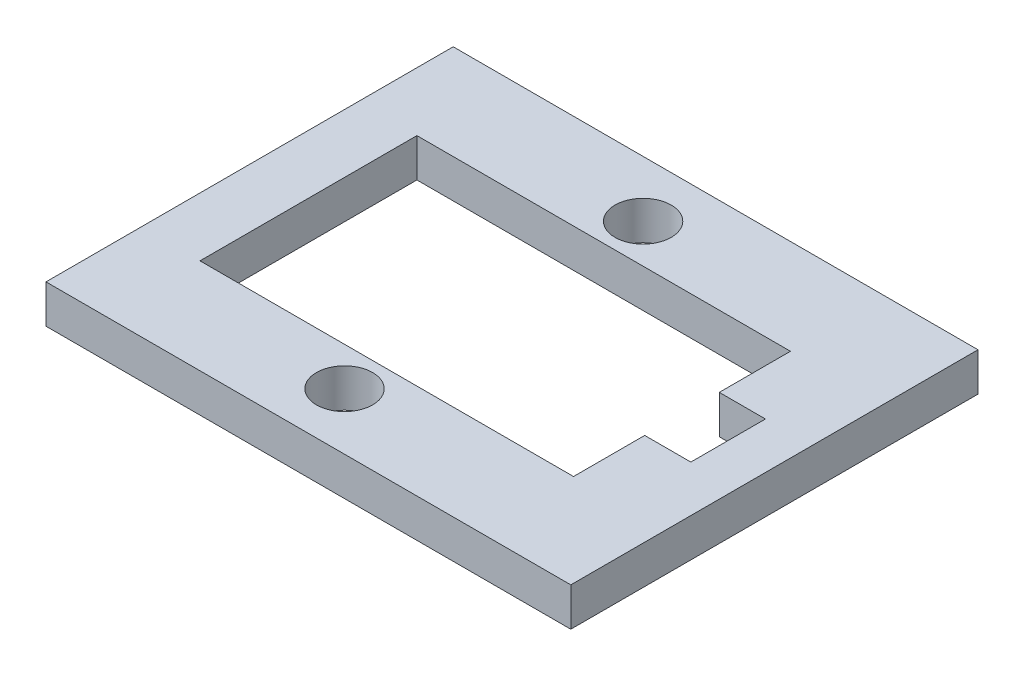
from build123d import *

# Parameters (mm, degrees)
SKETCH2_W           = 34.12443
SKETCH2_H           = 26.478152769
SKETCH2_R           = 1.825
BOSS_EXTRUDE1_DEPTH = 1.25


with BuildPart() as part:
    # Sketch2 → Boss-Extrude1 (new, symmetric)
    with BuildSketch(Plane(origin=(0, 0, 0), x_dir=(1, 0, 0), z_dir=(0, 1, 0))):
        with Locations((0.360723362, 0.777502601)):
            Rectangle(SKETCH2_W, SKETCH2_H)
        with Locations(Location((-0.702610465, 10.366481865, 0), (0, 0, 270))):
            Circle(SKETCH2_R, mode=Mode.SUBTRACT)
        with Locations(Location((-0.97805, -8.773518135, 0), (0, 0, 270))):
            Circle(SKETCH2_R, mode=Mode.SUBTRACT)
        Polygon((-12.878350873, 7.83354898), (11.411239127, 7.83354898), (11.411239127, 3.2058826), (14.411239127, 3.2058826), (14.411239127, -1.6439074), (11.411239127, -1.6439074), (11.411239127, -6.27157378), (-12.878350873, -6.27157378), align=None, mode=Mode.SUBTRACT)
    extrude(amount=BOSS_EXTRUDE1_DEPTH, both=True)


solid = part.part
